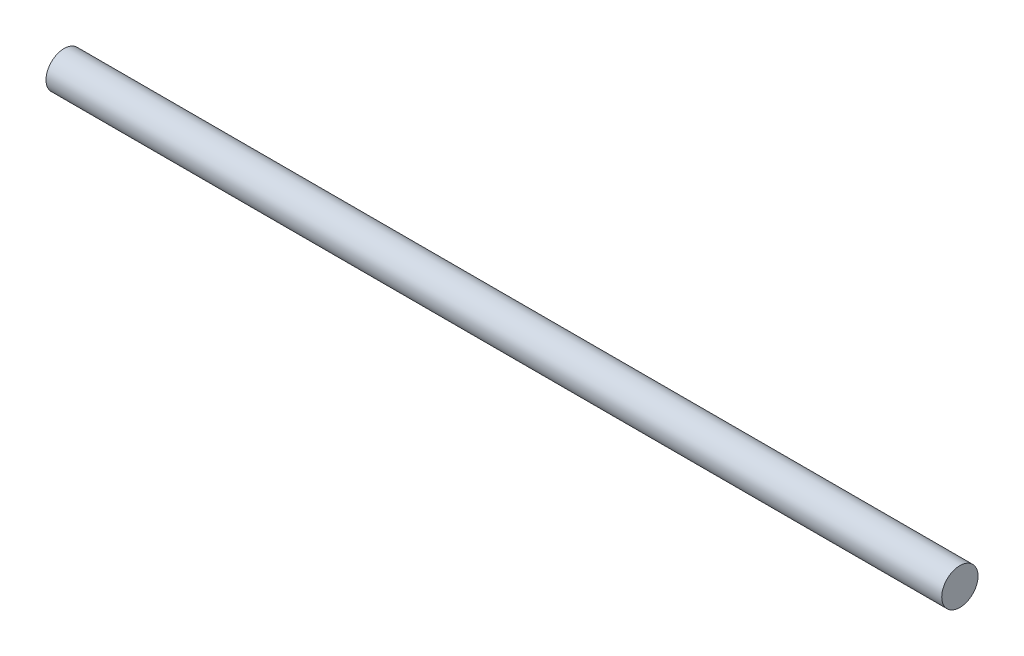
from build123d import *

# Parameters (mm, degrees)
ESQUISSE1_W = 74
ESQUISSE1_H = 1.5


with BuildPart() as part:
    # Esquisse1 → Révol.-Mince1 (revolve)
    with BuildSketch(Plane.XY, mode=Mode.PRIVATE) as r_vol_mince1_sk:
        with Locations((13.091839545, 0.75)):
            Rectangle(ESQUISSE1_W, ESQUISSE1_H)
    revolve(r_vol_mince1_sk.sketch.rotate(Axis((-23.908160455, 0, 0), (1, 0, 0)), 90), axis=Axis((-23.908160455, 0, 0), (1, 0, 0)))


solid = part.part
